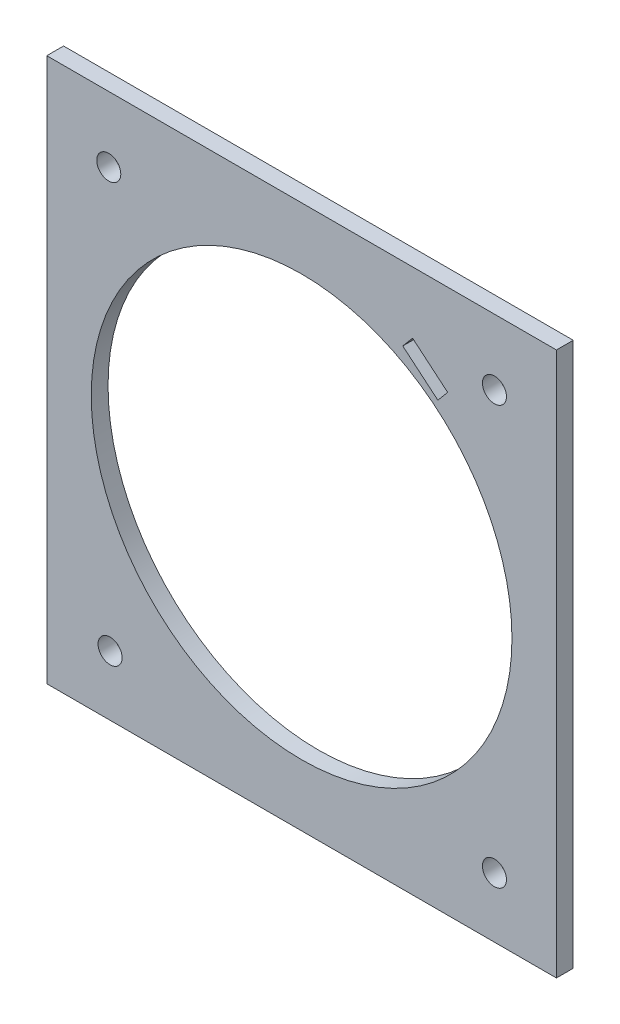
from build123d import *

# Parameters (mm, degrees)
SKETCH1_W               = 84.8
SKETCH1_H               = 90.5
BOSS_EXTRUDE1_DEPTH     = 2.794
CUT_EXTRUDE1_DEPTH      = 125.05279697
CUT_EXTRUDE1_DEPTH_BACK = 125.05279697
SKETCH2_R               = 2
CUT_EXTRUDE2_DEPTH      = 125.05279697
CUT_EXTRUDE2_DEPTH_BACK = 125.05279697
SKETCH3_R               = 1.7145
SKETCH4_R               = 35
CUT_EXTRUDE3_DEPTH      = 10
CUT_EXTRUDE4_DEPTH      = 10


with BuildPart() as part:
    # Sketch1 → Boss-Extrude1 (new body)
    with BuildSketch(Plane.XY):
        with Locations((42.4, -45.25)):
            Rectangle(SKETCH1_W, SKETCH1_H)
    extrude(amount=BOSS_EXTRUDE1_DEPTH)

    # Sketch2 → Cut-Extrude1 (cut, two sides: drawn at the far end of the back side and taken through both)
    with BuildSketch(Plane.XY.offset(2.794).offset(-CUT_EXTRUDE1_DEPTH_BACK)):
        with Locations((10.31500695, -10.904966862)):
            Circle(SKETCH2_R)
        with Locations((74.48499305, -10.904966862)):
            Circle(SKETCH2_R)
        with Locations((74.48499305, -80.5)):
            Circle(SKETCH2_R)
        with Locations((10.53300695, -80.5)):
            Circle(SKETCH2_R)
    extrude(amount=CUT_EXTRUDE1_DEPTH + CUT_EXTRUDE1_DEPTH_BACK, mode=Mode.SUBTRACT)

    # Sketch3 → Cut-Extrude2 (cut, two sides: drawn at the far end of the back side and taken through both)
    with BuildSketch(Plane(origin=(0, 0, 0), x_dir=(-1, 0, 0), z_dir=(0, 0, -1)).offset(-CUT_EXTRUDE2_DEPTH_BACK)):
        with Locations((-42.4, -45.25)):
            Circle(SKETCH3_R)
    extrude(amount=CUT_EXTRUDE2_DEPTH + CUT_EXTRUDE2_DEPTH_BACK, mode=Mode.SUBTRACT)

    # Sketch4 → Cut-Extrude3 (cut)
    with BuildSketch(Plane(origin=(0, 0, 0), x_dir=(-1, 0, 0), z_dir=(0, 0, -1))):
        with Locations((-42.4, -45.25)):
            Circle(SKETCH4_R)
    extrude(amount=-CUT_EXTRUDE3_DEPTH, mode=Mode.SUBTRACT)

    # Sketch5 → Cut-Extrude4 (cut)
    with BuildSketch(Plane.XY.offset(2.794)):
        Polygon((60.865488083, -10.264365241), (66.70274674, -15.162406827), (65.070066211, -17.108159712), (59.232807555, -12.210118127), align=None)
    extrude(amount=-CUT_EXTRUDE4_DEPTH, mode=Mode.SUBTRACT)


solid = part.part
